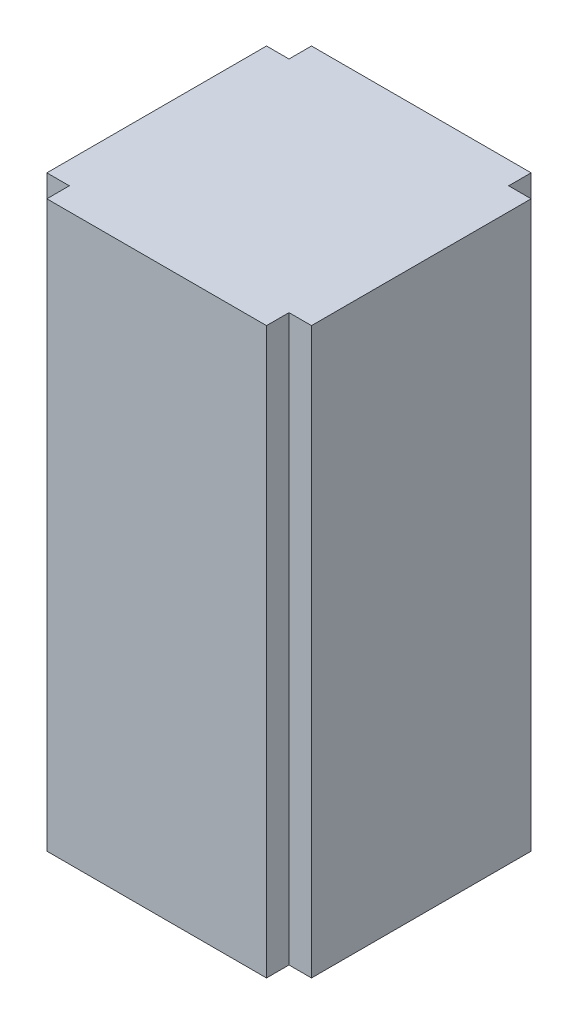
from build123d import *

# Parameters (mm, degrees)
BOSS_EXTRUDE1_DEPTH = 106.75


with BuildPart() as part:
    # Sketch1 → Boss-Extrude1 (new, symmetric)
    with BuildSketch(Plane(origin=(0, 0, 0), x_dir=(1, 0, 0), z_dir=(0, 1, 0))):
        Polygon((27.590820165, -51.69590185), (27.590820165, -43.19590185), (36.090820165, -43.19590185), (36.090820165, 39.80409815), (27.590820165, 39.80409815), (27.590820165, 48.30409815), (-55.409179835, 48.30409815), (-55.409179835, 39.80409815), (-63.909179835, 39.80409815), (-63.909179835, -43.19590185), (-55.409179835, -43.19590185), (-55.409179835, -51.69590185), align=None)
    extrude(amount=BOSS_EXTRUDE1_DEPTH, both=True)


solid = part.part
